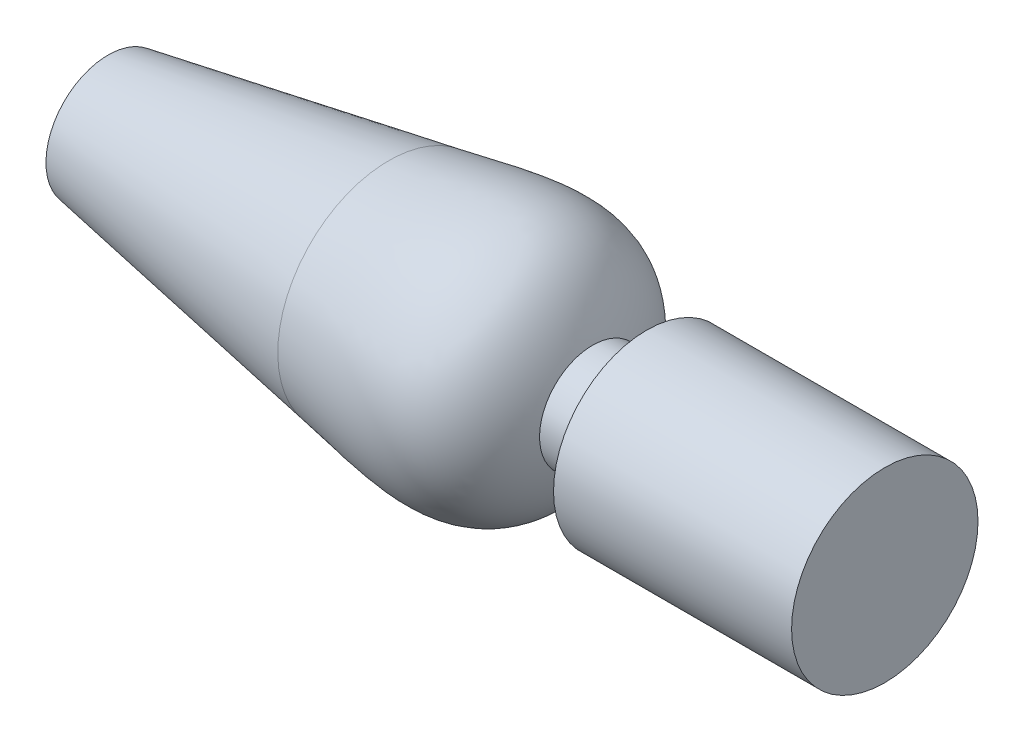
from build123d import *


with BuildPart() as part:
    # Sketch1 → Revolve1 (revolve)
    with BuildSketch(Plane.XY, mode=Mode.PRIVATE) as revolve1_sk:
        with BuildLine():
            Line((6.25, 0), (6.25, 1.5))
            Line((6.25, 1.5), (2.418439441, 1.5))
            Line((2.418439441, 1.5), (2.418439441, 0.85342731))
            Line((2.418439441, 0.85342731), (1.547351676, 0.85342731))
            add(Edge.make_bspline(
                [(-1.732235322, 1.787144344), (-0.144941343, 2.063703564), (0.965721254, 2.439168447), (1.547351676, 0.85342731)],
                knots=[0, 0, 0, 0, 1, 1, 1, 1], degree=3))
            Line((-1.732235322, 1.787144344), (-6.25, 1))
            Line((-6.25, 1), (-6.25, 0))
            Line((-6.25, 0), (6.25, 0))
        make_face()
    revolve(revolve1_sk.sketch.rotate(Axis((-6.25, 0, 0), (1, 0, 0)), 180), axis=Axis((-6.25, 0, 0), (1, 0, 0)))


solid = part.part
